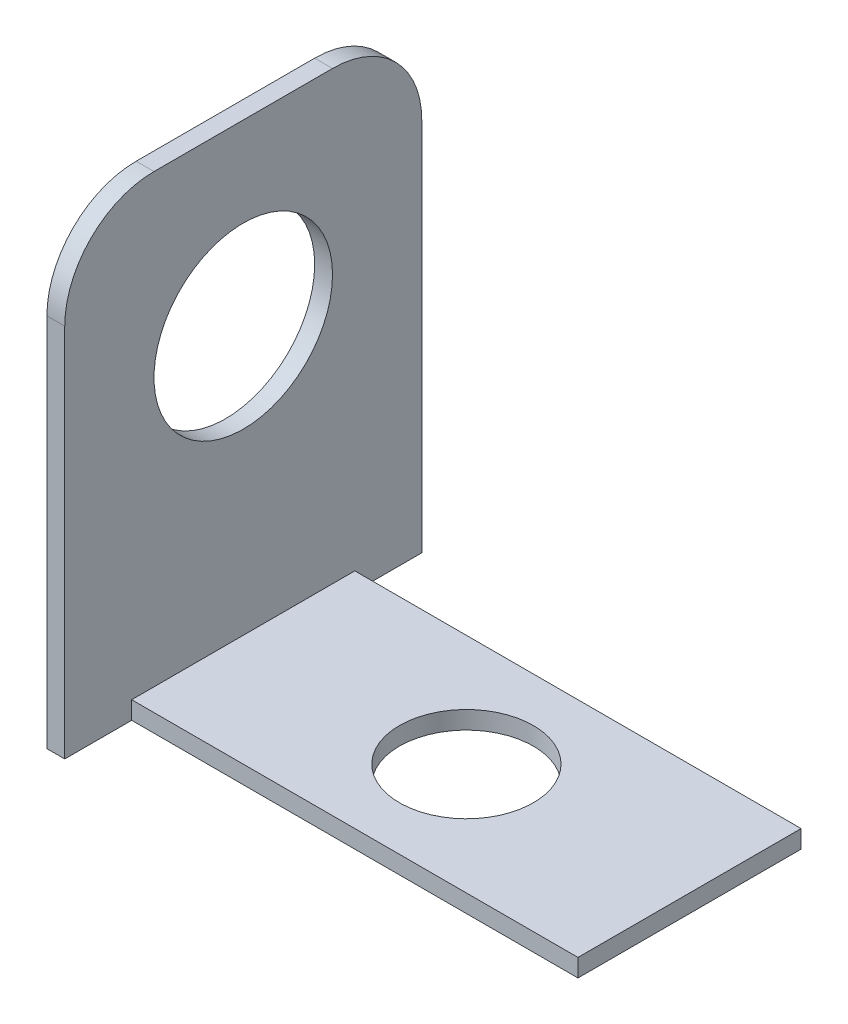
from build123d import *

# Parameters (mm, degrees)
RESSALTO_EXTRUS_O1_DEPTH = 40
ESBO_O2_R                = 10
CORTE_EXTRUS_O1_DEPTH    = 40
ESBO_O3_R                = 7.5
CORTE_EXTRUS_O2_DEPTH    = 40
FILETE1_R                = 10
ESBO_O4_W                = 50
ESBO_O4_H                = 7.5
CORTE_EXTRUS_O3_DEPTH    = 290


with BuildPart() as part:
    # Esboço1 → Ressalto-extrusão1 (new body)
    with BuildSketch(Plane.XY):
        Polygon((0, 0), (0, 50), (-2, 50), (-2, -2), (50, -2), (50, 0), align=None)
    extrude(amount=RESSALTO_EXTRUS_O1_DEPTH)

    # Esboço2 → Corte-extrusão1 (cut)
    with BuildSketch(Plane(origin=(0, 0, 0), x_dir=(0, 0, -1), z_dir=(1, 0, 0))):
        with Locations((-20, 30)):
            Circle(ESBO_O2_R)
    extrude(amount=-CORTE_EXTRUS_O1_DEPTH, mode=Mode.SUBTRACT)

    # Esboço3 → Corte-extrusão2 (cut)
    with BuildSketch(Plane(origin=(0, 0, 0), x_dir=(1, 0, 0), z_dir=(0, 1, 0))):
        with Locations(Location((25, -20, 0), (0, 0, 180))):
            Circle(ESBO_O3_R)
    extrude(amount=-CORTE_EXTRUS_O2_DEPTH, mode=Mode.SUBTRACT)

    # Filete1
    filete1_edges = [part.edges().sort_by_distance(p)[0] for p in [
        (-1, 50, 40),
        (-1, 50, 0),
    ]]
    fillet(filete1_edges, radius=FILETE1_R)

    # Esboço4 → Corte-extrusão3 (cut)
    with BuildSketch(Plane(origin=(0, 0, 0), x_dir=(1, 0, 0), z_dir=(0, 1, 0))):
        with Locations((25, -36.25)):
            Rectangle(ESBO_O4_W, ESBO_O4_H)
        with Locations((25, -3.75)):
            Rectangle(ESBO_O4_W, ESBO_O4_H)
    extrude(amount=-CORTE_EXTRUS_O3_DEPTH, mode=Mode.SUBTRACT)


solid = part.part
